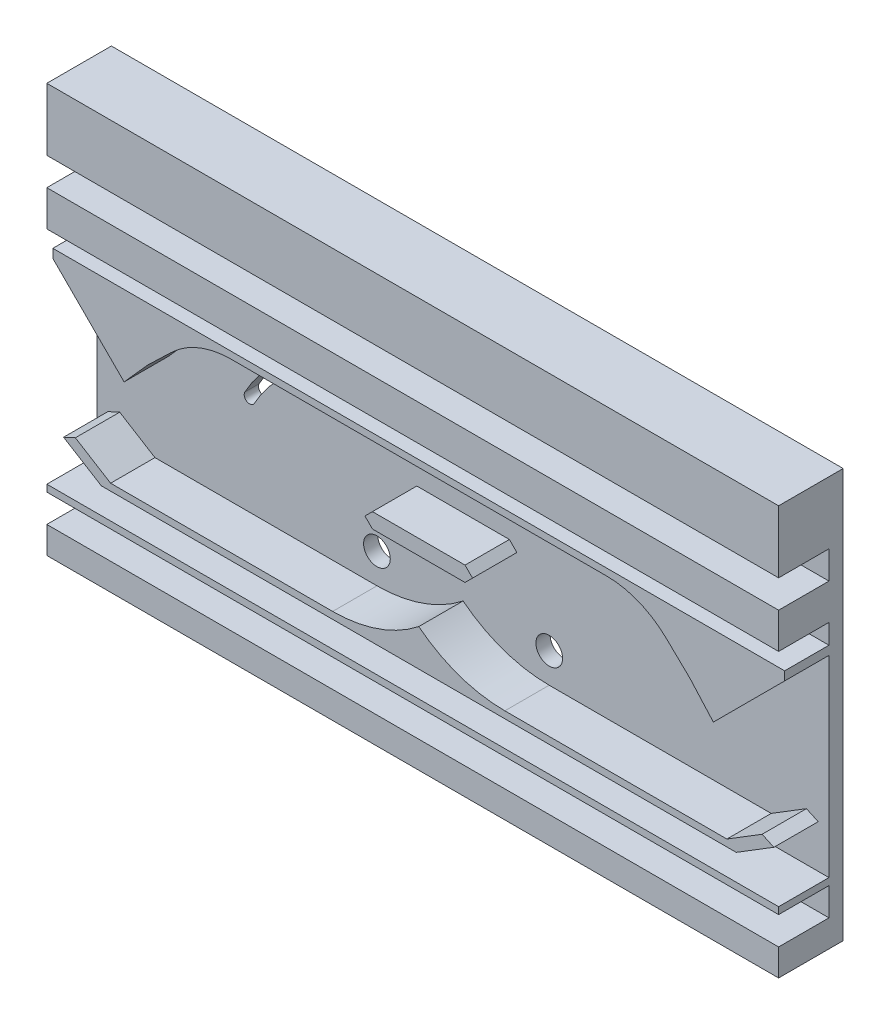
from build123d import *

# Parameters (mm, degrees)
SKETCH3_W          = 215.9
SKETCH3_H          = 120.65
EXTRUDE1_DEPTH     = 4.191
SKETCH4_W          = 215.9
SKETCH4_H          = 18.415
SKETCH4_H_2        = 10.541
SKETCH4_H_3        = 7.9375
SKETCH4_H_4        = 2.032
EXTRUDE2_DEPTH     = 19.05
EXTRUDE3_DEPTH     = 17.272
SKETCH8_R          = 3.937
SKETCH8_R_2        = 1.1303
CUT_EXTRUDE1_DEPTH = 19.05


with BuildPart() as part:
    # Sketch3 → Extrude1 (new body)
    with BuildSketch(Plane.XY):
        with Locations((381, 95.25)):
            Rectangle(SKETCH3_W, SKETCH3_H)
    extrude(amount=EXTRUDE1_DEPTH)

    # Sketch4 → Extrude2 (add)
    with BuildSketch(Plane.XY):
        with Locations((381, 146.3675)):
            Rectangle(SKETCH4_W, SKETCH4_H)
        with Locations((381, 123.6345)):
            Rectangle(SKETCH4_W, SKETCH4_H_2)
        with Locations((381, 38.89375)):
            Rectangle(SKETCH4_W, SKETCH4_H_3)
        with Locations((381, 52.1335)):
            Rectangle(SKETCH4_W, SKETCH4_H_4)
    extrude(amount=EXTRUDE2_DEPTH)

    # Sketch5 → Extrude3 (add)
    with BuildSketch(Plane.XY):
        with BuildLine():
            Line((381, 58.9915), (287.3375, 58.9915))
            Line((287.3375, 58.9915), (276.225, 65.8495))
            Line((276.225, 65.8495), (279.698182312, 67.437))
            Line((279.698182312, 67.437), (290.090427682, 61.0235))
            Line((290.090427682, 61.0235), (355.6, 61.0235))
            ThreePointArc((355.6, 61.0235), (369.044953535, 63.29299882), (381.000000001, 69.85))
            ThreePointArc((381.000000001, 69.85), (392.955046465, 63.29299882), (406.4, 61.0235))
            Line((406.4, 61.0235), (471.909572318, 61.0235))
            Line((471.909572318, 61.0235), (482.301817688, 67.437))
            Line((482.301817688, 67.437), (485.775, 65.8495))
            Line((485.775, 65.8495), (474.6625, 58.9915))
            Line((474.6625, 58.9915), (381, 58.9915))
        make_face()
        Polygon((381, 87.9475), (367.3475, 87.9475), (365.125, 90.17), (367.3475, 92.3925), (381, 92.3925), (394.6525, 92.3925), (396.875, 90.17), (394.6525, 87.9475), align=None)
        with BuildLine():
            Line((436.382792366, 110.49), (325.617207634, 110.49))
            ThreePointArc((325.617207634, 110.49), (316.127546422, 108.650694601), (308.012246242, 103.399159848))
            Line((308.012246242, 103.399159848), (300.99, 96.647))
            Line((300.99, 96.647), (294.082258334, 88.9))
            Line((294.082258334, 88.9), (273.05, 109.932258334))
            Line((273.05, 109.932258334), (273.05, 112.522))
            Line((273.05, 112.522), (488.95, 112.522))
            Line((488.95, 112.522), (488.95, 109.932258334))
            Line((488.95, 109.932258334), (467.917741666, 88.9))
            Line((467.917741666, 88.9), (461.01, 96.647))
            Line((461.01, 96.647), (453.987753758, 103.399159848))
            ThreePointArc((453.987753758, 103.399159848), (445.872453578, 108.650694601), (436.382792366, 110.49))
        make_face()
    extrude(amount=EXTRUDE3_DEPTH)

    # Sketch8 → Cut-Extrude1 (cut)
    with BuildSketch(Plane.XY):
        with Locations((355.582497028, 69.847540117)):
            Circle(SKETCH8_R)
        with Locations((406.417502972, 69.847540117)):
            Circle(SKETCH8_R)
        with Locations((381, 46.99)):
            Circle(SKETCH8_R_2)
        with Locations((460.95285, 46.99)):
            Circle(SKETCH8_R_2)
        with Locations((301.04715, 46.99)):
            Circle(SKETCH8_R_2)
        with BuildLine():
            ThreePointArc((319.409826978, 89.545574531), (322.509420435, 94.391866743), (326.25811196, 98.755505093))
            ThreePointArc((326.25811196, 98.755505093), (326.161980776, 101.078429217), (323.852023449, 100.815152101))
            ThreePointArc((323.852023449, 100.815152101), (319.896382713, 96.191952728), (316.621455618, 91.063998107))
            ThreePointArc((316.621455618, 91.063998107), (317.25642951, 88.910600639), (319.409826978, 89.545574531))
        make_face()
        with BuildLine():
            ThreePointArc((438.147976551, 100.815152101), (442.103617287, 96.191952728), (445.378544382, 91.063998107))
            ThreePointArc((445.378544382, 91.063998107), (444.74357049, 88.910600639), (442.590173022, 89.545574531))
            ThreePointArc((442.590173022, 89.545574531), (439.490579565, 94.391866743), (435.74188804, 98.755505093))
            ThreePointArc((435.74188804, 98.755505093), (435.838019224, 101.078429217), (438.147976551, 100.815152101))
        make_face()
    extrude(amount=CUT_EXTRUDE1_DEPTH, mode=Mode.SUBTRACT)


solid = part.part
